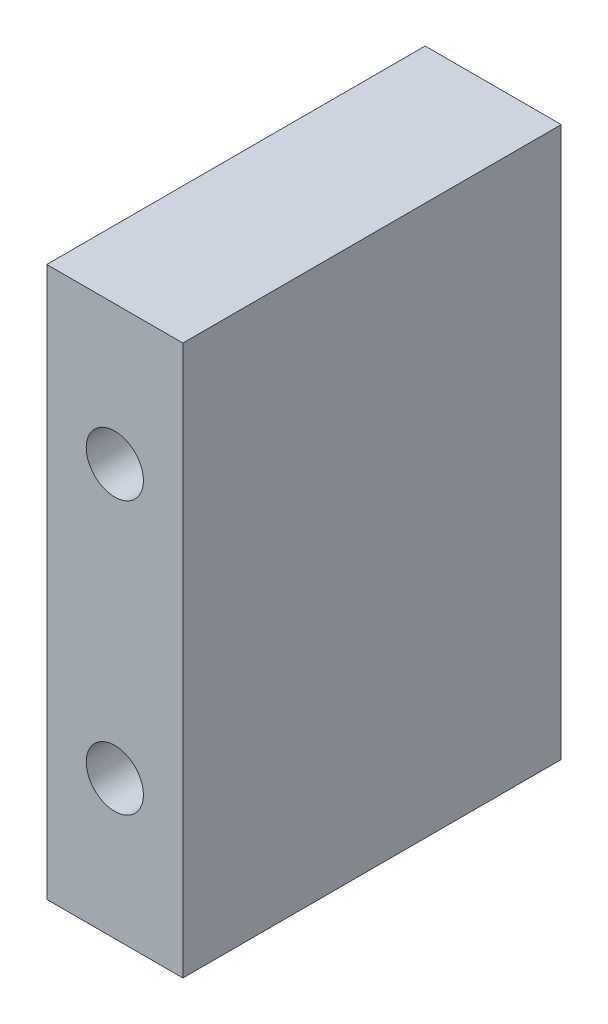
from build123d import *

# Parameters (mm, degrees)
ESQUISSE1_W             = 5
ESQUISSE1_H             = 20.2
BOSS_EXTRU_1_DEPTH      = 13.9
ESQUISSE4_R             = 1.05
ENL_V_MAT_EXTRU_1_DEPTH = 18.362891464


with BuildPart() as part:
    # Esquisse1 → Boss.-Extru.1 (new body)
    with BuildSketch(Plane.XY):
        Rectangle(ESQUISSE1_W, ESQUISSE1_H)
    extrude(amount=BOSS_EXTRU_1_DEPTH)

    # Esquisse4 → Enlèv. mat.-Extru.1 (cut, through all)
    with BuildSketch(Plane(origin=(0, 0, 0), x_dir=(-1, 0, 0), z_dir=(0, 0, -1))):
        with Locations((0, 5)):
            Circle(ESQUISSE4_R)
        with Locations((0, -5)):
            Circle(ESQUISSE4_R)
    extrude(amount=-ENL_V_MAT_EXTRU_1_DEPTH, mode=Mode.SUBTRACT)


solid = part.part
